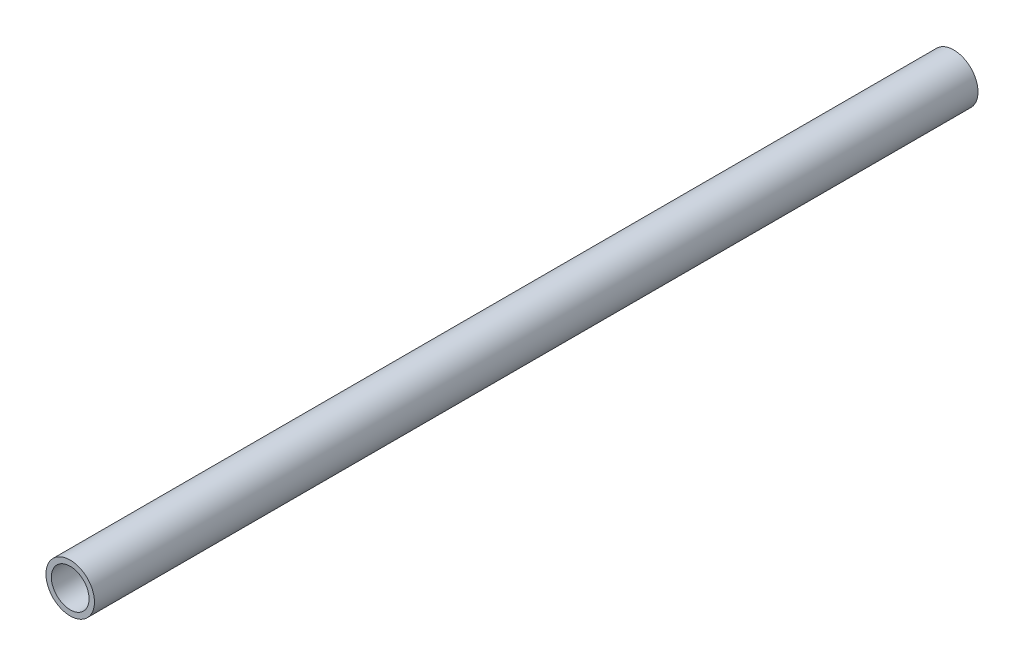
from build123d import *

# Parameters (mm, degrees)
SKETCH1_R           = 9
SKETCH1_R_2         = 7
BOSS_EXTRUDE1_DEPTH = 327.978


with BuildPart() as part:
    # Sketch1 → Boss-Extrude1 (new body)
    with BuildSketch(Plane.XY):
        Circle(SKETCH1_R)
        Circle(SKETCH1_R_2, mode=Mode.SUBTRACT)
    extrude(amount=BOSS_EXTRUDE1_DEPTH)


solid = part.part
